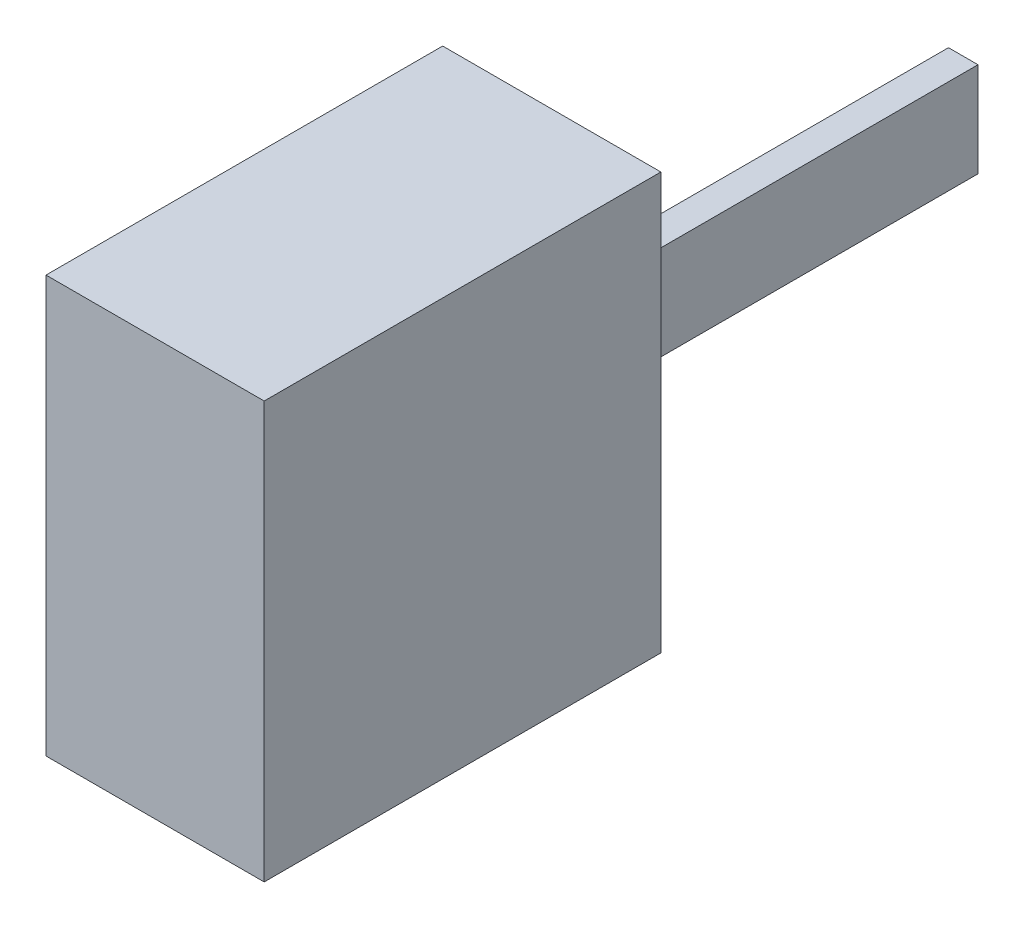
from build123d import *

# Parameters (mm, degrees)
SKETCH1_W           = 33
SKETCH1_H           = 63
BOSS_EXTRUDE1_DEPTH = 60
SKETCH1_3_W         = 4.466715852
SKETCH1_3_H         = 14.293859793
BOSS_EXTRUDE2_DEPTH = 60


with BuildPart() as part:
    # Sketch1 → Boss-Extrude1 (new body)
    with BuildSketch(Plane.XY):
        with Locations((0, -5.625)):
            Rectangle(SKETCH1_W, SKETCH1_H)
    extrude(amount=BOSS_EXTRUDE1_DEPTH)

    # Sketch1<3> → Boss-Extrude2 (add)
    with BuildSketch(Plane.XY):
        with Locations((2.233357926, -3.23810571)):
            Rectangle(SKETCH1_3_W, SKETCH1_3_H)
    extrude(amount=-BOSS_EXTRUDE2_DEPTH)


solid = part.part
